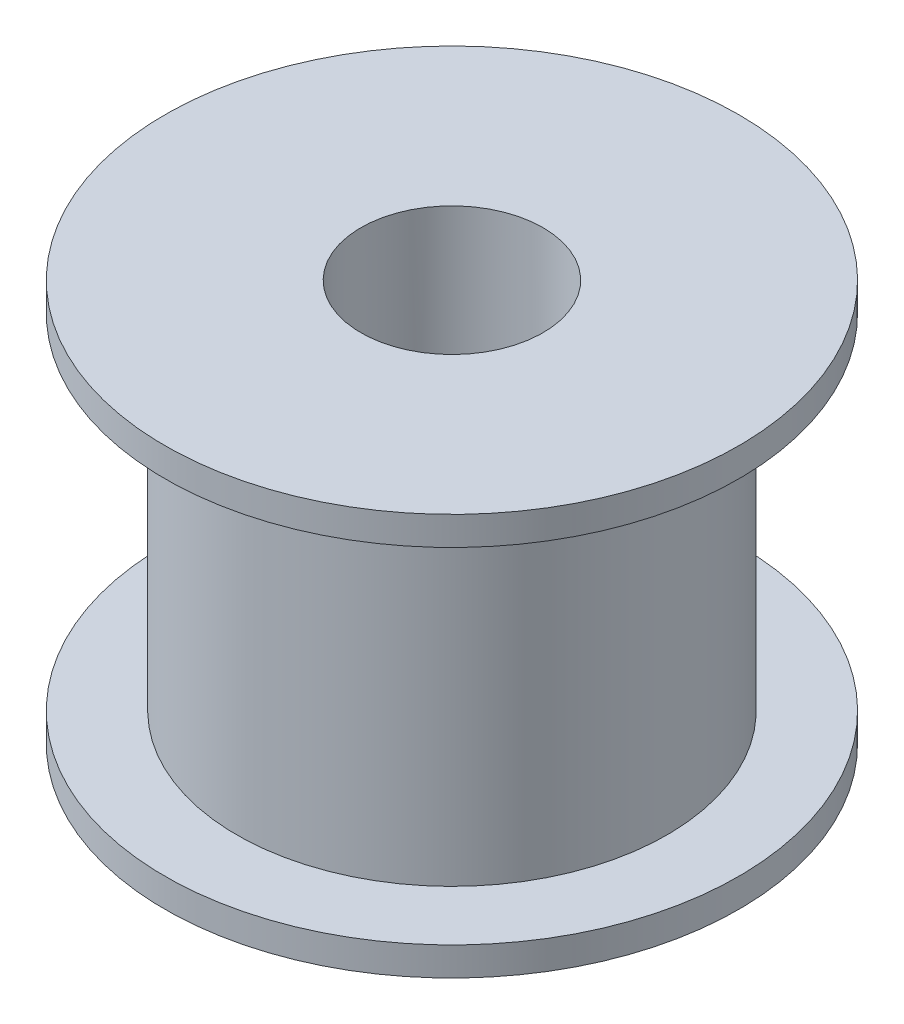
from build123d import *

# Parameters (mm, degrees)
CUT_EXTRUDE1_REACH      = 29.857
CUT_EXTRUDE1_END_RADIUS = 7.5
SKETCH2_R               = 1.6
CUT_EXTRUDE2_REACH      = 29.857
CUT_EXTRUDE2_END_RADIUS = 7.5
SKETCH3_R               = 1.6


with BuildPart() as part:
    # Sketch1 → Revolve1 (revolve)
    with BuildSketch(Plane.XY, mode=Mode.PRIVATE) as revolve1_sk:
        Polygon((-3.175, 10), (-3.175, 24), (-10, 24), (-10, 23), (-7.5, 23), (-7.5, 11), (-10, 11), (-10, 10), align=None)
    revolve(revolve1_sk.sketch.rotate(Axis((0, 0, 0), (0, 1, 0)), 270), axis=Axis((0, 0, 0), (0, 1, 0)))

    # Cut-Extrude1: up to this cylinder (the profile starts inside it)
    cut_extrude1_end = Plane(origin=(0, 17, 0), z_dir=(0, -1, 0)) * Cylinder(CUT_EXTRUDE1_END_RADIUS, 75.714, mode=Mode.PRIVATE)
    # Sketch2 → Cut-Extrude1 (cut, up to the surface)
    with BuildSketch(Plane.XY, mode=Mode.PRIVATE) as cut_extrude1_sk1:
        with Locations((0, 17)):
            Circle(SKETCH2_R)
    cut_extrude1_tool1 = extrude(cut_extrude1_sk1.sketch, amount=-CUT_EXTRUDE1_REACH, mode=Mode.PRIVATE) & cut_extrude1_end
    add(cut_extrude1_tool1.solids().sort_by_distance((0, 17, 0))[0], mode=Mode.SUBTRACT)

    # Cut-Extrude2: up to this cylinder (the profile starts inside it)
    cut_extrude2_end = Plane(origin=(0, 17, 0), z_dir=(0, -1, 0)) * Cylinder(CUT_EXTRUDE2_END_RADIUS, 75.714, mode=Mode.PRIVATE)
    # Sketch3 → Cut-Extrude2 (cut, up to the surface)
    with BuildSketch(Plane(origin=(0, 0, 0), x_dir=(0, 0, -1), z_dir=(1, 0, 0)), mode=Mode.PRIVATE) as cut_extrude2_sk1:
        with Locations((0, 17)):
            Circle(SKETCH3_R)
    cut_extrude2_tool1 = extrude(cut_extrude2_sk1.sketch, amount=-CUT_EXTRUDE2_REACH, mode=Mode.PRIVATE) & cut_extrude2_end
    add(cut_extrude2_tool1.solids().sort_by_distance((0, 17, 0))[0], mode=Mode.SUBTRACT)


solid = part.part
